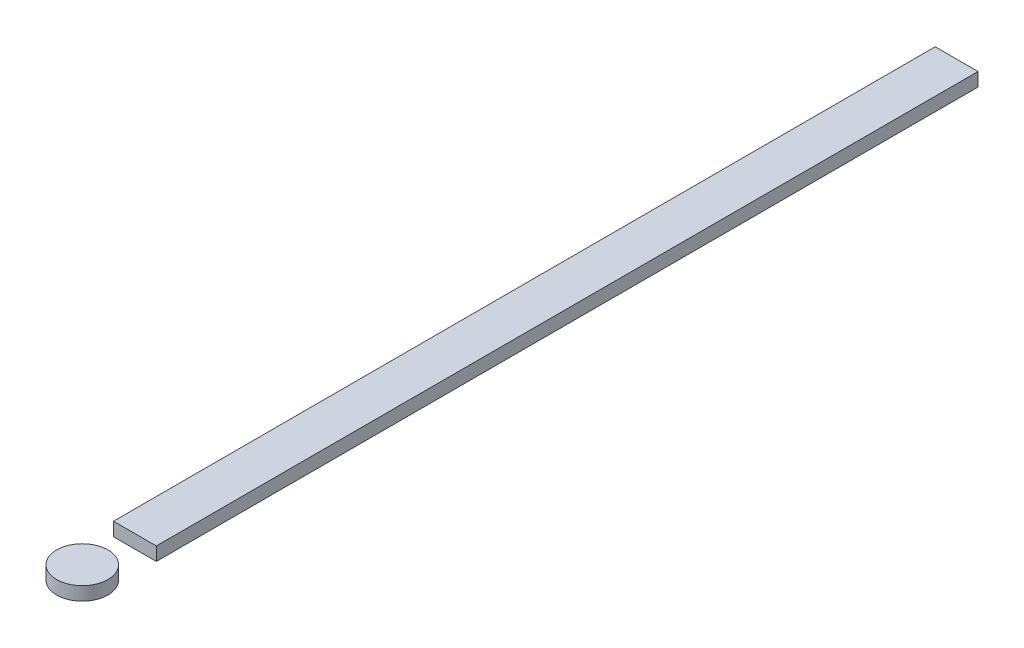
from build123d import *

# Parameters (mm, degrees)
SKETCH1_R           = 1.905
BOSS_EXTRUDE1_DEPTH = 1
SKETCH2_W           = 3.175
SKETCH2_H           = 60.96
BOSS_EXTRUDE2_DEPTH = 1


with BuildPart() as part:
    # Sketch1 → Boss-Extrude1 (new body)
    with BuildSketch(Plane(origin=(0, 0, 0), x_dir=(1, 0, 0), z_dir=(0, 1, 0))):
        with Locations(Location((0, 0, 0), (0, 0, 270))):
            Circle(SKETCH1_R)
    extrude(amount=BOSS_EXTRUDE1_DEPTH)


with BuildPart() as body_2:
    # Sketch2 → Boss-Extrude2 (new body)
    with BuildSketch(Plane(origin=(0, 0, 0), x_dir=(1, 0, 0), z_dir=(0, 1, 0))):
        with Locations((-0.048166493, 34.431945888)):
            Rectangle(SKETCH2_W, SKETCH2_H)
    extrude(amount=BOSS_EXTRUDE2_DEPTH)


solid = Compound([part.part, body_2.part])
